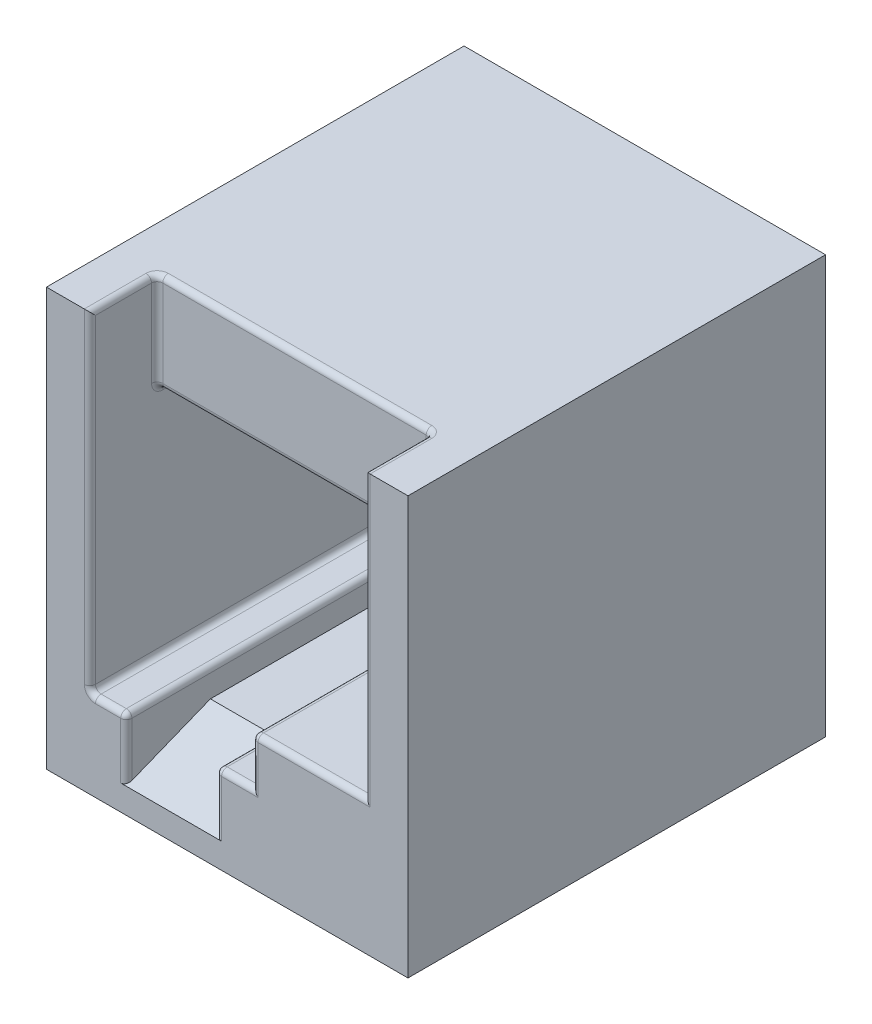
from build123d import *

# Parameters (mm, degrees)
SKETCH1_W      = 12.9
SKETCH1_H      = 14.9
EXTRUDE1_DEPTH = 14.9
SKETCH2_W      = 9.8
SKETCH2_H      = 3.5
EXTRUDE2_DEPTH = 2.4
EXTRUDE3_DEPTH = 12.5
CHAMFER1_SIZE  = 1.2
CHAMFER1_SIZE2 = 3
FILLET1_R      = 0.2


with BuildPart() as part:
    # Sketch1 → Extrude1 (new body)
    with BuildSketch(Plane.XY):
        with Locations((6.45, 7.45)):
            Rectangle(SKETCH1_W, SKETCH1_H)
    extrude(amount=-EXTRUDE1_DEPTH)

    # Sketch2 → Extrude2 (cut)
    with BuildSketch(Plane.XY):
        with Locations((6.45, 13.15)):
            Rectangle(SKETCH2_W, SKETCH2_H)
    extrude(amount=-EXTRUDE2_DEPTH, mode=Mode.SUBTRACT)

    # Sketch3 → Extrude3 (cut)
    with BuildSketch(Plane.XY):
        Polygon((1.55, 11.4), (1.55, 3.1), (2.85, 3.1), (2.85, 2.1), (6.05, 2.1), (6.05, 3.1), (7.35, 3.1), (7.35, 4.8), (11.35, 4.8), (11.35, 11.4), align=None)
    extrude(amount=-EXTRUDE3_DEPTH, mode=Mode.SUBTRACT)

    # Chamfer1
    chamfer1_edges = [part.edges().sort_by_distance(p)[0] for p in [
        (4.45, 2.1, 0),
    ]]
    chamfer1_side = [part.faces().sort_by_distance(p)[0] for p in [
        (0.775, 14.702916261, 0),
    ]]
    chamfer(chamfer1_edges, length=CHAMFER1_SIZE, length2=CHAMFER1_SIZE2, reference=chamfer1_side[0])

    # Fillet1
    fillet1_edges = [part.edges().sort_by_distance(p)[0] for p in [
        (1.55, 13.15, -2.4),
        (6.45, 14.9, -2.4),
        (1.55, 14.9, -1.2),
        (11.35, 13.15, -2.4),
        (11.35, 14.9, -1.2),
        (6.45, 11.4, -2.4),
        (1.55, 9, 0),
        (11.35, 9.85, 0),
        (6.45, 11.4, -12.5),
        (1.55, 11.4, -7.45),
        (11.35, 8.1, -12.5),
        (11.35, 11.4, -7.45),
        (9.35, 4.8, -12.5),
        (7.35, 3.95, -12.5),
        (7.35, 4.8, -6.25),
        (6.7, 3.1, -12.5),
        (6.05, 2.6, -12.5),
        (6.05, 3.1, -6.25),
        (2.85, 2.6, -12.5),
        (2.2, 3.1, -12.5),
        (2.85, 3.1, -6.25),
        (1.55, 7.25, -12.5),
        (1.55, 3.1, -6.25),
        (2.2, 3.1, 0),
        (2.85, 2, 0),
        (6.05, 2, 0),
        (6.7, 3.1, 0),
        (7.35, 3.95, 0),
        (9.35, 4.8, 0),
    ]]
    fillet(fillet1_edges, radius=FILLET1_R)


solid = part.part
